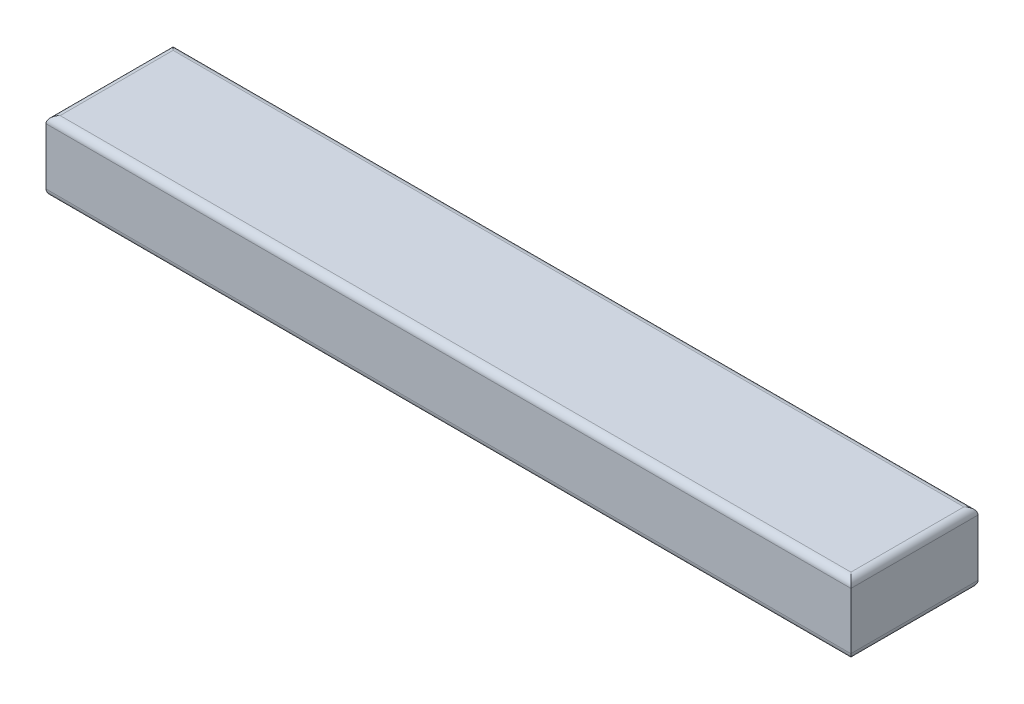
from build123d import *

# Parameters (mm, degrees)
SKETCH2_W           = 28.956
SKETCH2_H           = 4.572
BOSS_EXTRUDE1_DEPTH = 2.54
FILLET1_R           = 0.254


with BuildPart() as part:
    # Sketch2 → Boss-Extrude1 (new body)
    with BuildSketch(Plane(origin=(0, 0, 0), x_dir=(1, 0, 0), z_dir=(0, 1, 0))):
        Rectangle(SKETCH2_W, SKETCH2_H)
    extrude(amount=BOSS_EXTRUDE1_DEPTH)

    # Fillet1
    fillet1_edges = [part.edges().sort_by_distance(p)[0] for p in [
        (14.478, 2.54, 0),
        (0, 2.54, -2.286),
        (-14.478, 2.54, 0),
        (0, 0, -2.286),
        (14.478, 0, 0),
        (0, 0, 2.286),
        (-14.478, 0, 0),
        (0, 2.54, 2.286),
    ]]
    fillet(fillet1_edges, radius=FILLET1_R)


solid = part.part
